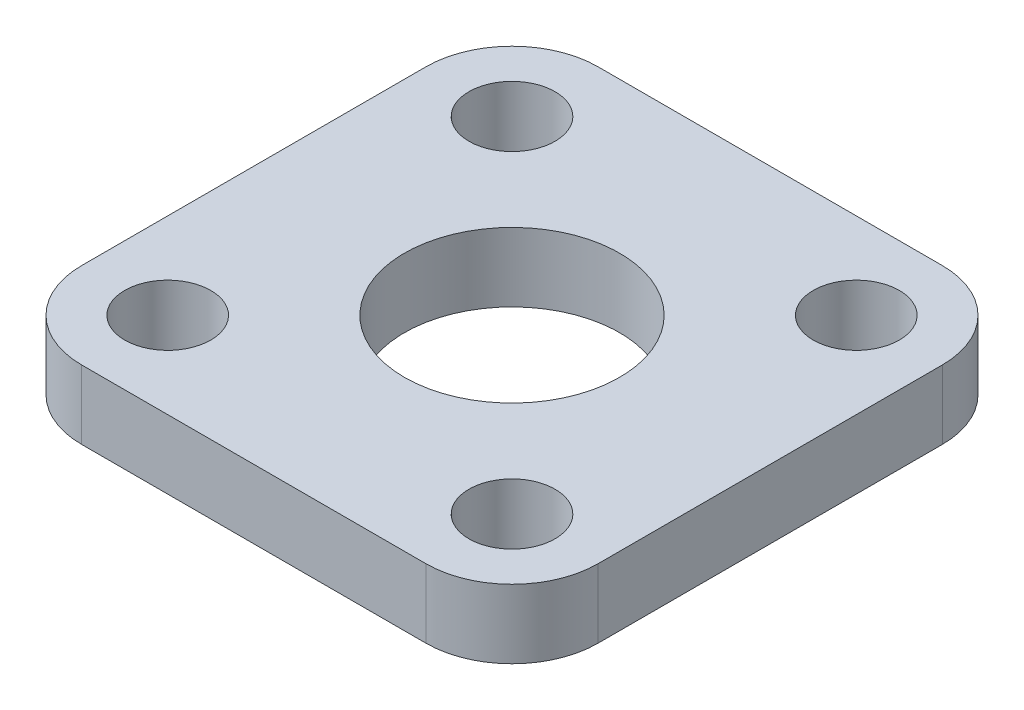
from build123d import *

# Parameters (mm, degrees)
SKETCH1_W           = 19.05
SKETCH1_H           = 19.05
SKETCH1_R           = 1.5875
SKETCH1_R_2         = 3.96875
BOSS_EXTRUDE1_DEPTH = 2.54
FILLET2_R           = 3.175


with BuildPart() as part:
    # Sketch1 → Boss-Extrude1 (new body)
    with BuildSketch(Plane(origin=(0, 0, 0), x_dir=(1, 0, 0), z_dir=(0, 1, 0))):
        Rectangle(SKETCH1_W, SKETCH1_H)
        with Locations(Location((-6.35, 6.35, 0), (0, 0, 270))):
            Circle(SKETCH1_R, mode=Mode.SUBTRACT)
        with Locations(Location((6.35, 6.35, 0), (0, 0, 270))):
            Circle(SKETCH1_R, mode=Mode.SUBTRACT)
        with Locations(Location((6.35, -6.35, 0), (0, 0, 270))):
            Circle(SKETCH1_R, mode=Mode.SUBTRACT)
        with Locations(Location((-6.35, -6.35, 0), (0, 0, 270))):
            Circle(SKETCH1_R, mode=Mode.SUBTRACT)
        with Locations(Location((0, 0, 0), (0, 0, 270))):
            Circle(SKETCH1_R_2, mode=Mode.SUBTRACT)
    extrude(amount=BOSS_EXTRUDE1_DEPTH)

    # Fillet2
    fillet2_edges = [part.edges().sort_by_distance(p)[0] for p in [
        (9.525, 1.27, 9.525),
        (-9.525, 1.27, 9.525),
        (-9.525, 1.27, -9.525),
        (9.525, 1.27, -9.525),
    ]]
    fillet(fillet2_edges, radius=FILLET2_R)


solid = part.part
